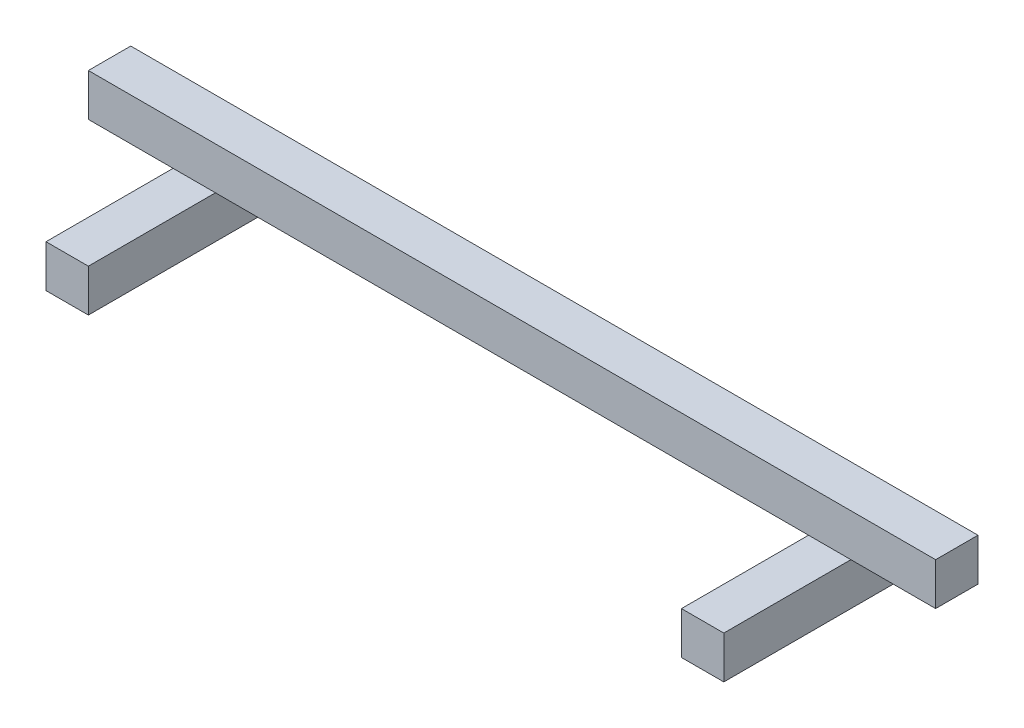
from build123d import *

# Parameters (mm, degrees)
SKETCH5_W             = 762
SKETCH5_H             = 38.1
BOSS_EXTRUDE3_DEPTH   = 38.1
SKETCH4_W             = 38.1
SKETCH4_H             = 38.1
BOSS_EXTRUDE4_DEPTH   = 152.4
BOSS_EXTRUDE4_2_DEPTH = 152.4


with BuildPart() as part:
    # Sketch5 → Boss-Extrude3 (new body)
    with BuildSketch(Plane(origin=(0, 0, 0), x_dir=(1, 0, 0), z_dir=(0, 1, 0))):
        Rectangle(SKETCH5_W, SKETCH5_H)
    extrude(amount=BOSS_EXTRUDE3_DEPTH)


with BuildPart() as body_2:
    # Sketch4 → Boss-Extrude4 (new body)
    with BuildSketch(Plane.XY.offset(-19.05)):
        with Locations((285.75, -19.05)):
            Rectangle(SKETCH4_W, SKETCH4_H)
    extrude(amount=BOSS_EXTRUDE4_DEPTH)


with BuildPart() as body_3:
    # Sketch4 → Boss-Extrude4 2 (new body)
    with BuildSketch(Plane.XY.offset(-19.05)):
        with Locations((-285.75, -19.05)):
            Rectangle(SKETCH4_W, SKETCH4_H)
    extrude(amount=BOSS_EXTRUDE4_2_DEPTH)


solid = Compound([part.part, body_2.part, body_3.part])
